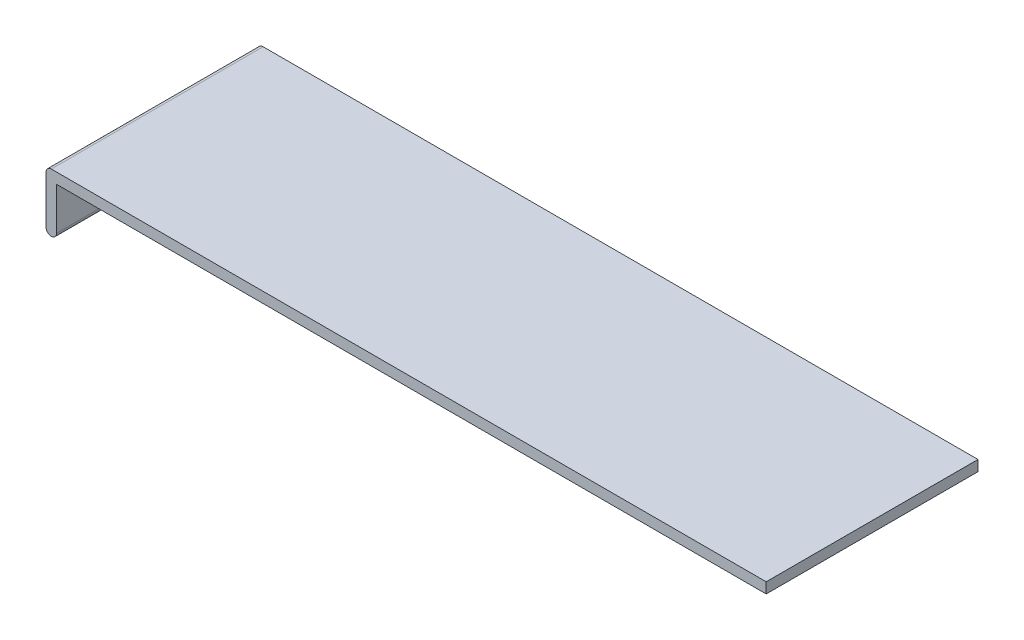
from build123d import *

# Parameters (mm, degrees)
RESSALTO_EXTRUS_O1_DEPTH = 4


with BuildPart() as part:
    # Esboço1 → Ressalto-extrusão1 (new body)
    with BuildSketch(Plane.XY):
        with BuildLine():
            Line((0.1, 0), (0.1, 0.8))
            Line((0.1, 0.8), (13.5, 0.8))
            Line((13.5, 0.8), (13.5, 1))
            Line((13.5, 1), (0, 1))
            ThreePointArc((0, 1), (-0.070710678, 0.970710678), (-0.1, 0.9))
            Line((-0.1, 0.9), (-0.1, 0.8))
            Line((-0.1, 0.8), (-0.1, 0))
            ThreePointArc((-0.1, 0), (0, -0.1), (0.1, 0))
        make_face()
    extrude(amount=RESSALTO_EXTRUS_O1_DEPTH)


solid = part.part
